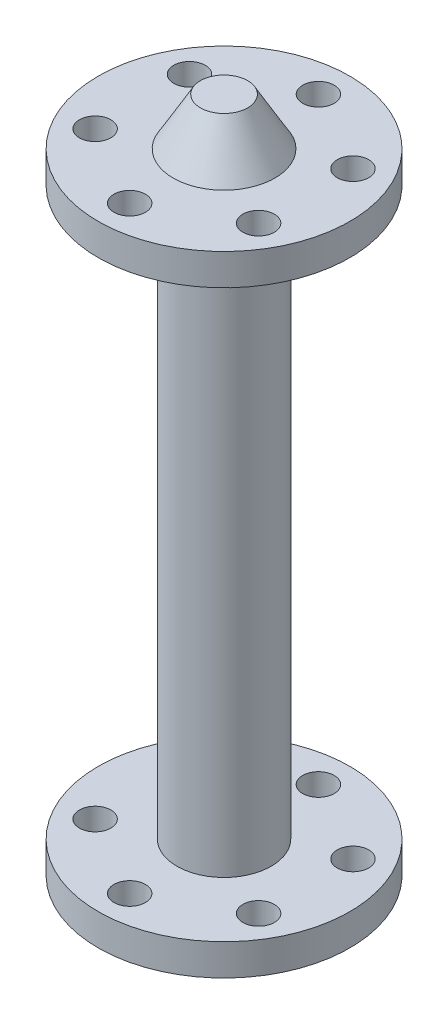
from build123d import *

# Parameters (mm, degrees)
F_1_0MM_DOWEL_HOLE1_D = 20
CIRPATTERN1_COUNT     = 6


with BuildPart() as part:
    # Sketch1 → Revolve1 (revolve)
    with BuildSketch(Plane.XY, mode=Mode.PRIVATE) as revolve1_sk:
        Polygon((0, 72.472952852), (15, 72.472952852), (32.320508076, 42.472952852), (80, 42.472952852), (80, 22.472952852), (30, 22.472952852), (30, -337.527047148), (80, -337.527047148), (80, -357.527047148), (32.320508076, -357.527047148), (15, -387.527047148), (0, -387.527047148), align=None)
    revolve(revolve1_sk.sketch.rotate(Axis((0, 72.472952852, 0), (0, -1, 0)), 180), axis=Axis((0, 72.472952852, 0), (0, -1, 0)))

    # Ø1.0mm Dowel Hole1 (through all)
    with Locations(Plane(origin=(0, 42.472952852, 0), x_dir=(1, 0, 0), z_dir=(0, 1, 0))):
        with Locations((0, 60)):
            f_1_0mm_dowel_hole1 = Hole(F_1_0MM_DOWEL_HOLE1_D / 2)

    # CirPattern1: Ø1.0mm Dowel Hole1 ×6 about axis
    cirpattern1_axis = Axis((0, 0, 0), (0, 1, 0))
    for i in range(1, CIRPATTERN1_COUNT):
        add(f_1_0mm_dowel_hole1.rotate(cirpattern1_axis, i * 360 / CIRPATTERN1_COUNT), mode=Mode.SUBTRACT)


solid = part.part
